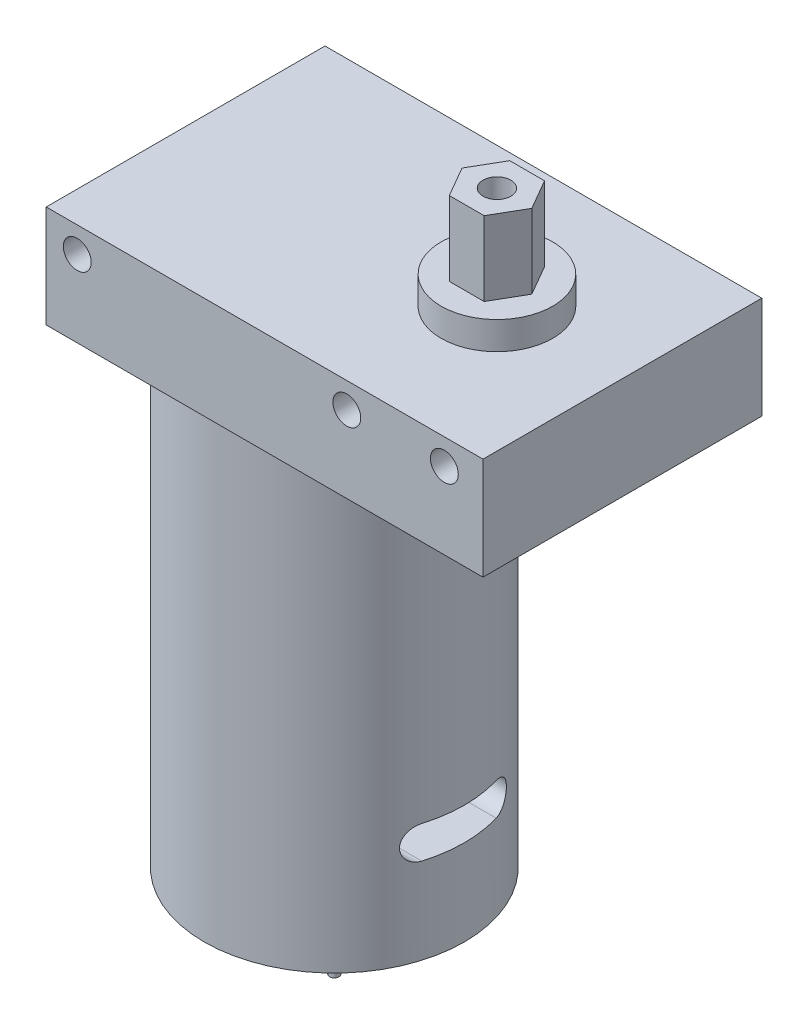
from build123d import *

# Parameters (mm, degrees)
SKETCH_1_W          = 47
SKETCH_1_H          = 30
EXTRUDE_1_DEPTH     = 11
SKETCH_2_R          = 6
EXTRUDE_2_DEPTH     = 3
EXTRUDE_3_DEPTH     = 8
SKETCH_4_R          = 14
EXTRUDE_4_DEPTH     = 50
SKETCH_5_R          = 5
EXTRUDE_5_DEPTH     = 2
SKETCH_6_R          = 1.5
CUT_EXTRUDE_1_DEPTH = 77.243032469
CUT_EXTRUDE_2_DEPTH = 77.243032469
SKETCH_9_R          = 1.5
CUT_EXTRUDE_3_DEPTH = 8
SKETCH_11_R         = 0.5
EXTRUDE_6_DEPTH     = 8


with BuildPart() as part:
    # 草图1 → 凸台-拉伸1 (new body)
    with BuildSketch(Plane(origin=(0, 0, 0), x_dir=(1, 0, 0), z_dir=(0, 1, 0))):
        with Locations((23.5, -15)):
            Rectangle(SKETCH_1_W, SKETCH_1_H)
    extrude(amount=EXTRUDE_1_DEPTH)

    # 草图2 → 凸台-拉伸2 (add)
    with BuildSketch(Plane(origin=(0, 11, 0), x_dir=(1, 0, 0), z_dir=(0, 1, 0))):
        with Locations(Location((33.5, -15, 0), (0, 0, 270))):
            Circle(SKETCH_2_R)
    extrude(amount=EXTRUDE_2_DEPTH)

    # 草图3 → 凸台-拉伸3 (add)
    with BuildSketch(Plane(origin=(0, 14, 0), x_dir=(1, 0, 0), z_dir=(0, 1, 0))):
        Polygon((37.25277675, -15), (35.376388375, -11.75), (31.623611625, -11.75), (29.74722325, -15), (31.623611625, -18.25), (35.376388375, -18.25), align=None)
    extrude(amount=EXTRUDE_3_DEPTH)

    # 草图4 → 凸台-拉伸4 (add)
    with BuildSketch(Plane.XZ):
        with Locations(Location((16, 15, 0), (0, 0, 90))):
            Circle(SKETCH_4_R)
    extrude(amount=EXTRUDE_4_DEPTH)

    # 草图5 → 凸台-拉伸5 (add)
    with BuildSketch(Plane.XZ.offset(50)):
        with Locations(Location((16, 15, 0), (0, 0, 270))):
            Circle(SKETCH_5_R)
    extrude(amount=EXTRUDE_5_DEPTH)

    # 草图6 → 切除-拉伸1 (cut, through all)
    with BuildSketch(Plane.XY.offset(30)):
        with Locations((3.340757383, 8.25)):
            Circle(SKETCH_6_R)
        with Locations((32.340757383, 8.25)):
            Circle(SKETCH_6_R)
        with Locations((42.840757383, 8.25)):
            Circle(SKETCH_6_R)
    extrude(amount=-CUT_EXTRUDE_1_DEPTH, mode=Mode.SUBTRACT)

    # 草图7 → 切除-拉伸2 (cut, through all)
    with BuildSketch(Plane.ZY):
        with BuildLine():
            Line((11, -37.25), (19, -37.25))
            ThreePointArc((19, -37.25), (20.75, -39), (19, -40.75))
            Line((19, -40.75), (11, -40.75))
            ThreePointArc((11, -40.75), (9.25, -39), (11, -37.25))
        make_face()
    extrude(amount=-CUT_EXTRUDE_2_DEPTH, mode=Mode.SUBTRACT)

    # 草图9 → 切除-拉伸3 (cut)
    with BuildSketch(Plane(origin=(0, 22, 0), x_dir=(1, 0, 0), z_dir=(0, 1, 0))):
        with Locations(Location((33.5, -15, 0), (0, 0, 270))):
            Circle(SKETCH_9_R)
    extrude(amount=-CUT_EXTRUDE_3_DEPTH, mode=Mode.SUBTRACT)

    # 草图11 → 凸台-拉伸6 (add)
    with BuildSketch(Plane.XZ.offset(52)):
        with Locations(Location((16, 15, 0), (0, 0, 270))):
            Circle(SKETCH_11_R)
    extrude(amount=EXTRUDE_6_DEPTH)


solid = part.part
